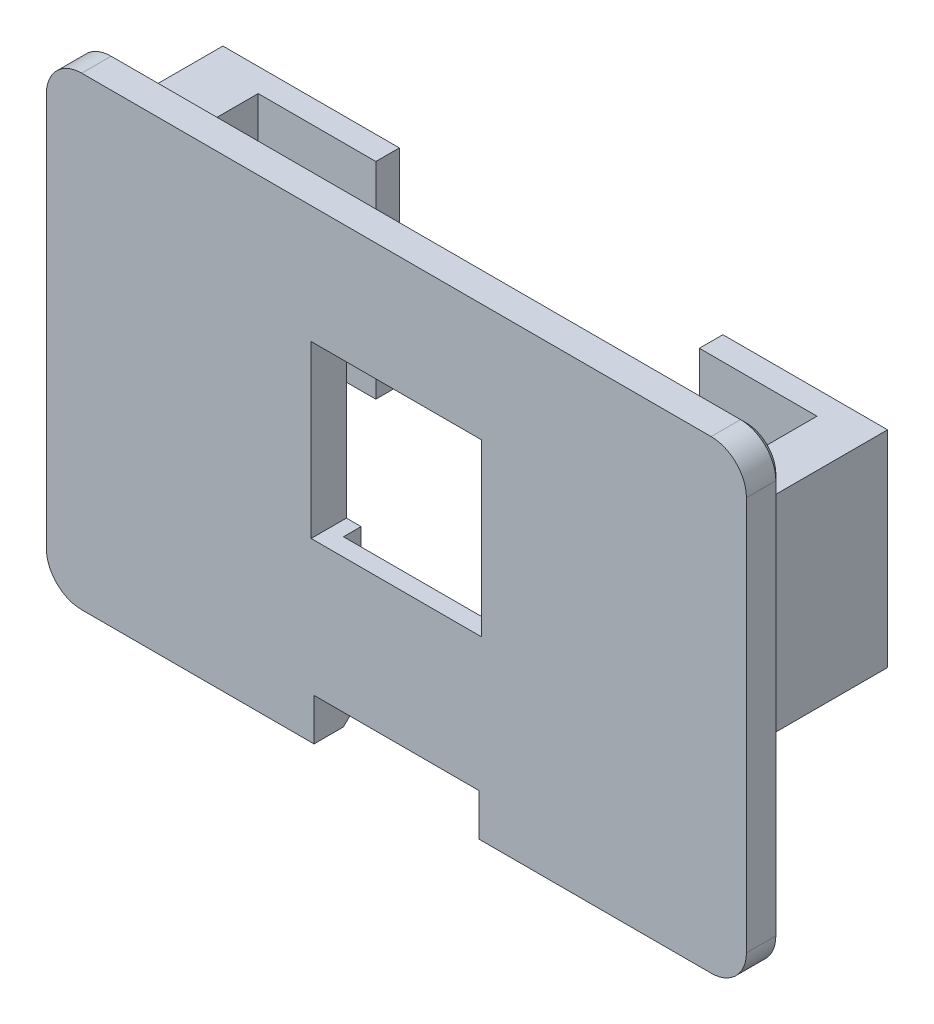
from build123d import *

# Parameters (mm, degrees)
SKETCH2_W           = 59.5
SKETCH2_H           = 39.5
BOSS_EXTRUDE1_DEPTH = 3
FILLET1_R           = 3
CHAMFER1_SIZE       = 0.5
SKETCH3_W           = 14
SKETCH3_H           = 17.5
SKETCH3_W_2         = 15
BOSS_EXTRUDE2_DEPTH = 10.5
CUT_EXTRUDE1_REACH  = 43.077
SKETCH4_W           = 14
SKETCH4_H           = 3.577165811
SKETCH4_W_2         = 14.5
SKETCH4_H_2         = 14.5
SKETCH5_W           = 12
SKETCH5_H           = 15
CUT_EXTRUDE2_DEPTH  = 1.5
SKETCH6_W           = 7
SKETCH6_H           = 17.5
CUT_EXTRUDE3_DEPTH  = 10
SKETCH7_W           = 7
SKETCH7_H           = 17.5
CUT_EXTRUDE4_DEPTH  = 10


with BuildPart() as part:
    # Sketch2 → Boss-Extrude1 (new body)
    with BuildSketch(Plane.XY.offset(122.238514037)):
        with Locations((-4.628679656, 0.128679656)):
            Rectangle(SKETCH2_W, SKETCH2_H)
    extrude(amount=BOSS_EXTRUDE1_DEPTH)

    # Fillet1
    fillet1_edges = [part.edges().sort_by_distance(p)[0] for p in [
        (-34.378679656, 19.878679656, 123.738514037),
        (25.121320344, 19.878679656, 123.738514037),
        (25.121320344, -19.621320344, 123.738514037),
        (-34.378679656, -19.621320344, 123.738514037),
    ]]
    fillet(fillet1_edges, radius=FILLET1_R)

    # Chamfer1
    chamfer1_edges = [part.edges().sort_by_distance(p)[0] for p in [
        (-34.378679656, 0.128679656, 122.238514037),
        (-4.628679656, 19.878679656, 122.238514037),
        (25.121320344, 0.128679656, 122.238514037),
        (-4.628679656, -19.621320344, 122.238514037),
        (-33.5, -18.742640687, 122.238514037),
        (24.242640687, -18.742640687, 122.238514037),
        (24.242640687, 19, 122.238514037),
        (-33.5, 19, 122.238514037),
    ]]
    chamfer(chamfer1_edges, length=CHAMFER1_SIZE)

    # Sketch3 → Boss-Extrude2 (add)
    with BuildSketch(Plane(origin=(0, 0, 122.238514037), x_dir=(-1, 0, 0), z_dir=(0, 0, -1))):
        with Locations((-16.621320344, 5.628679656)):
            Rectangle(SKETCH3_W, SKETCH3_H)
        with Locations((25.378679656, 5.628679656)):
            Rectangle(SKETCH3_W_2, SKETCH3_H)
    extrude(amount=BOSS_EXTRUDE2_DEPTH)

    # Sketch4 → Cut-Extrude1 (cut, up to next)
    with BuildSketch(Plane(origin=(0, 0, 122.238514037), x_dir=(-1, 0, 0), z_dir=(0, 0, -1)), mode=Mode.PRIVATE) as cut_extrude1_sk1:
        with Locations((4.628679656, -17.832737439)):
            Rectangle(SKETCH4_W, SKETCH4_H)
    cut_extrude1_tool1 = extrude(cut_extrude1_sk1.sketch, amount=-CUT_EXTRUDE1_REACH, mode=Mode.PRIVATE) & part.part
    # Sketch4 → Cut-Extrude1 (cut, up to next)
    with BuildSketch(Plane(origin=(0, 0, 122.238514037), x_dir=(-1, 0, 0), z_dir=(0, 0, -1)), mode=Mode.PRIVATE) as cut_extrude1_sk2:
        with Locations((4.628679656, 2.628679656)):
            Rectangle(SKETCH4_W_2, SKETCH4_H_2)
    cut_extrude1_tool2 = extrude(cut_extrude1_sk2.sketch, amount=-CUT_EXTRUDE1_REACH, mode=Mode.PRIVATE) & part.part
    add(cut_extrude1_tool1.solids().sort_by_distance((-4.62868, -17.832737, 122.238514))[0], mode=Mode.SUBTRACT)
    add(cut_extrude1_tool2.solids().sort_by_distance((-4.62868, 2.62868, 122.238514))[0], mode=Mode.SUBTRACT)

    # Sketch5 → Cut-Extrude2 (cut)
    with BuildSketch(Plane(origin=(0, 0, 122.238514037), x_dir=(-1, 0, 0), z_dir=(0, 0, -1))):
        with Locations((4.628679656, -8.544154533)):
            Rectangle(SKETCH5_W, SKETCH5_H)
    extrude(amount=-CUT_EXTRUDE2_DEPTH, mode=Mode.SUBTRACT)

    # Sketch6 → Cut-Extrude3 (cut)
    with BuildSketch(Plane.ZY.offset(-9.621320344)):
        with Locations((117.238514037, 5.628679656)):
            Rectangle(SKETCH6_W, SKETCH6_H)
    extrude(amount=-CUT_EXTRUDE3_DEPTH, mode=Mode.SUBTRACT)

    # Sketch7 → Cut-Extrude4 (cut)
    with BuildSketch(Plane(origin=(-17.878679656, 0, 0), x_dir=(0, 0, -1), z_dir=(1, 0, 0))):
        with Locations((-117.238514037, 5.628679656)):
            Rectangle(SKETCH7_W, SKETCH7_H)
    extrude(amount=-CUT_EXTRUDE4_DEPTH, mode=Mode.SUBTRACT)


solid = part.part
